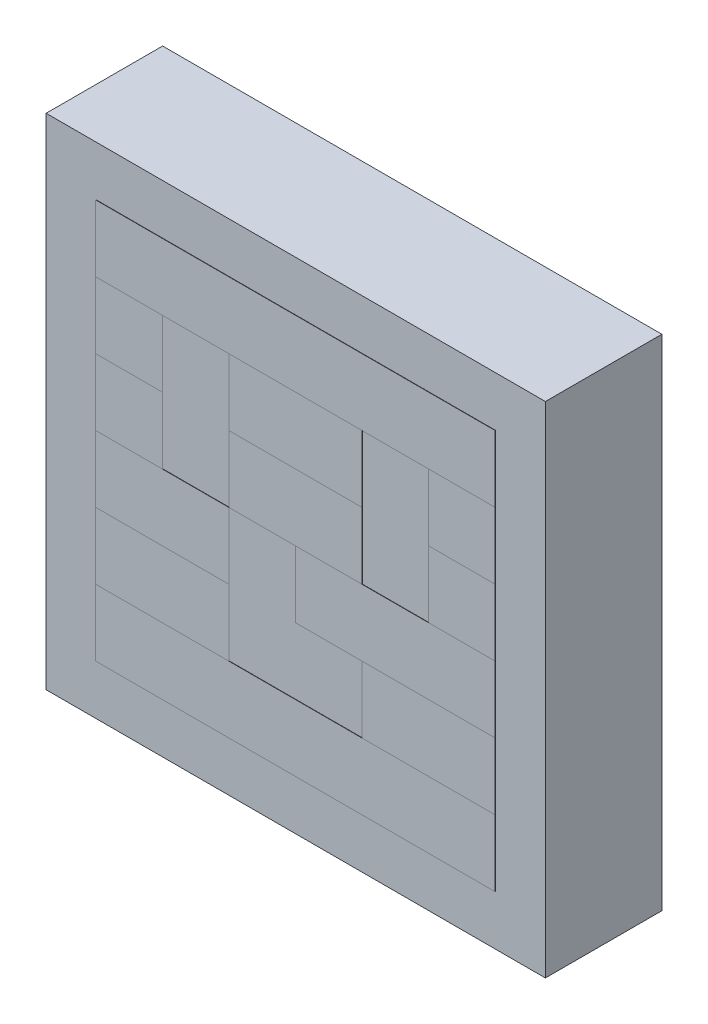
from build123d import *

# Parameters (mm, degrees)
SKETCH_1_W                     = 60
SKETCH_1_H                     = 60
COPLANAR_SUPPORT60X60X14_DEPTH = 14
SKETCH_2_W                     = 48
SKETCH_2_H                     = 8
ID3_ROW0_DEPTH                 = 0.04
SKETCH_3_W                     = 8
SKETCH_3_H                     = 8
ID3_ROW1_DEPTH                 = 0.04
SKETCH_3_W_2                   = 16
ID3_ROW1_2_DEPTH               = 0.04
ID3_ROW1_3_DEPTH               = 0.04
SKETCH_4_W                     = 8
SKETCH_4_H                     = 8
ID3_ROW2_DEPTH                 = 0.04
SKETCH_4_W_2                   = 16
ID3_ROW2_2_DEPTH               = 0.04
ID3_ROW2_3_DEPTH               = 0.04
SKETCH_5_W                     = 16
SKETCH_5_H                     = 8
ID3_ROW3_DEPTH                 = 0.04
SKETCH_5_W_2                   = 24
ID3_ROW3_2_DEPTH               = 0.04
SKETCH_6_W                     = 16
SKETCH_6_H                     = 8
ID3_ROW4_DEPTH                 = 0.04
ID3_ROW4_2_DEPTH               = 0.04
SKETCH_7_W                     = 48
SKETCH_7_H                     = 8
ID3_ROW5_DEPTH                 = 0.04


with BuildPart() as part:
    # 草图1 → Coplanar_support60x60x14 (new body)
    with BuildSketch(Plane.XY):
        Rectangle(SKETCH_1_W, SKETCH_1_H)
    extrude(amount=-COPLANAR_SUPPORT60X60X14_DEPTH)


with BuildPart() as body_2:
    # 草图2 → ID3_row0 (new body)
    with BuildSketch(Plane.XY):
        with Locations((0, 20)):
            Rectangle(SKETCH_2_W, SKETCH_2_H)
    extrude(amount=ID3_ROW0_DEPTH)


with BuildPart() as body_3:
    # 草图3 → ID3_row1 (new body)
    with BuildSketch(Plane.XY):
        with Locations((-20, 12)):
            Rectangle(SKETCH_3_W, SKETCH_3_H)
    extrude(amount=ID3_ROW1_DEPTH)


with BuildPart() as body_4:
    # 草图3 → ID3_row1 2 (new body)
    with BuildSketch(Plane.XY):
        with Locations((0, 12)):
            Rectangle(SKETCH_3_W_2, SKETCH_3_H)
    extrude(amount=ID3_ROW1_2_DEPTH)


with BuildPart() as body_5:
    # 草图3 → ID3_row1 3 (new body)
    with BuildSketch(Plane.XY):
        with Locations((20, 12)):
            Rectangle(SKETCH_3_W, SKETCH_3_H)
    extrude(amount=ID3_ROW1_3_DEPTH)


with BuildPart() as body_6:
    # 草图4 → ID3_row2 (new body)
    with BuildSketch(Plane.XY):
        with Locations((-20, 4)):
            Rectangle(SKETCH_4_W, SKETCH_4_H)
    extrude(amount=ID3_ROW2_DEPTH)


with BuildPart() as body_7:
    # 草图4 → ID3_row2 2 (new body)
    with BuildSketch(Plane.XY):
        with Locations((0, 4)):
            Rectangle(SKETCH_4_W_2, SKETCH_4_H)
    extrude(amount=ID3_ROW2_2_DEPTH)


with BuildPart() as body_8:
    # 草图4 → ID3_row2 3 (new body)
    with BuildSketch(Plane.XY):
        with Locations((20, 4)):
            Rectangle(SKETCH_4_W, SKETCH_4_H)
    extrude(amount=ID3_ROW2_3_DEPTH)


with BuildPart() as body_9:
    # 草图5 → ID3_row3 (new body)
    with BuildSketch(Plane.XY):
        with Locations((-16, -4)):
            Rectangle(SKETCH_5_W, SKETCH_5_H)
    extrude(amount=ID3_ROW3_DEPTH)


with BuildPart() as body_10:
    # 草图5 → ID3_row3 2 (new body)
    with BuildSketch(Plane.XY):
        with Locations((12, -4)):
            Rectangle(SKETCH_5_W_2, SKETCH_5_H)
    extrude(amount=ID3_ROW3_2_DEPTH)


with BuildPart() as body_11:
    # 草图6 → ID3_row4 (new body)
    with BuildSketch(Plane.XY):
        with Locations((-16, -12)):
            Rectangle(SKETCH_6_W, SKETCH_6_H)
    extrude(amount=ID3_ROW4_DEPTH)


with BuildPart() as body_12:
    # 草图6 → ID3_row4 2 (new body)
    with BuildSketch(Plane.XY):
        with Locations((16, -12)):
            Rectangle(SKETCH_6_W, SKETCH_6_H)
    extrude(amount=ID3_ROW4_2_DEPTH)


with BuildPart() as body_13:
    # 草图7 → ID3_row5 (new body)
    with BuildSketch(Plane.XY):
        with Locations((0, -20)):
            Rectangle(SKETCH_7_W, SKETCH_7_H)
    extrude(amount=ID3_ROW5_DEPTH)


solid = Compound([part.part, body_2.part, body_3.part, body_4.part, body_5.part, body_6.part, body_7.part, body_8.part, body_9.part, body_10.part, body_11.part, body_12.part, body_13.part])
